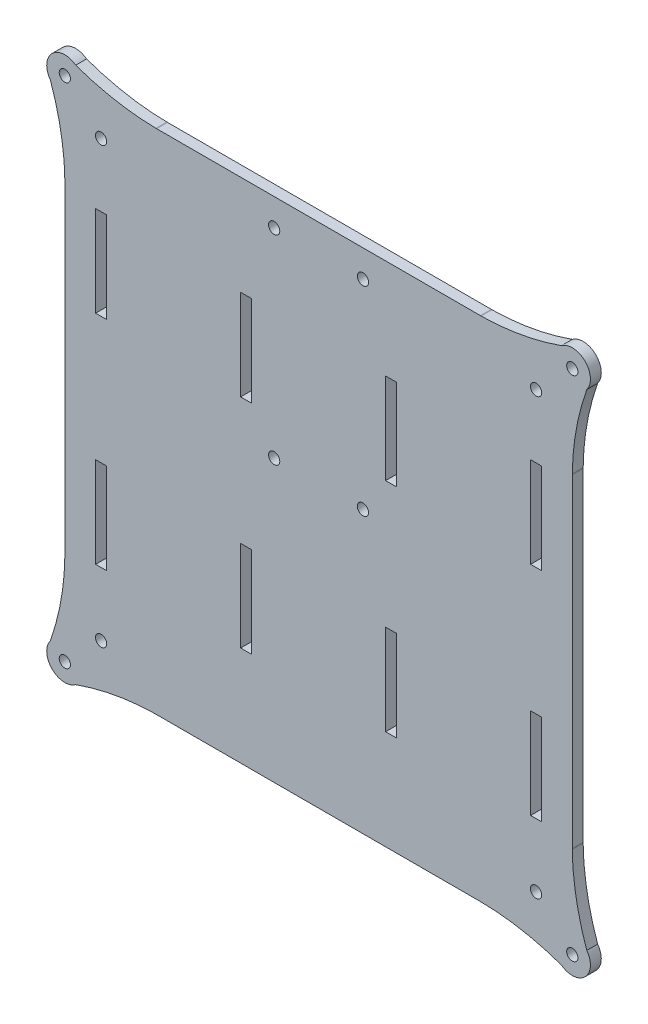
from build123d import *

# Parameters (mm, degrees)
SKETCH_1_W          = 140
SKETCH_1_H          = 140
SKETCH_1_R          = 1.55
EXTRUDE_1_DEPTH     = 3
SKETCH_2_R          = 1.55
SKETCH_2_W          = 3
SKETCH_2_H          = 25
CUT_EXTRUDE_1_DEPTH = 100.040395799
SKETCH_3_R          = 3
SKETCH_3_R_2        = 1.55
EXTRUDE_2_DEPTH     = 3
FILLET_1_R          = 10
SKETCH_7_W          = 252.152927368
SKETCH_7_H          = 251.6818607
CUT_EXTRUDE_3_DEPTH = 3
SKETCH_8_R          = 1.55
CUT_EXTRUDE_4_DEPTH = 3


with BuildPart() as part:
    # 草圖1 → 填料-伸長1 (new body)
    with BuildSketch(Plane.XY):
        Rectangle(SKETCH_1_W, SKETCH_1_H)
        with Locations((-60, 60)):
            Circle(SKETCH_1_R, mode=Mode.SUBTRACT)
        with Locations((60, 60)):
            Circle(SKETCH_1_R, mode=Mode.SUBTRACT)
        with Locations((60, -60)):
            Circle(SKETCH_1_R, mode=Mode.SUBTRACT)
        with Locations((-60, -60)):
            Circle(SKETCH_1_R, mode=Mode.SUBTRACT)
    extrude(amount=EXTRUDE_1_DEPTH)

    # 草圖2 → 除料-伸長1 (cut, through all)
    with BuildSketch(Plane.XY.offset(3)):
        with Locations((-12.25, 62.5)):
            Circle(SKETCH_2_R)
        with Locations((12.25, 62.5)):
            Circle(SKETCH_2_R)
        with Locations((-12.25, 7.5)):
            Circle(SKETCH_2_R)
        with Locations((12.25, 7.5)):
            Circle(SKETCH_2_R)
        with Locations((-60, -30)):
            Rectangle(SKETCH_2_W, SKETCH_2_H)
        with Locations((-60, 30)):
            Rectangle(SKETCH_2_W, SKETCH_2_H)
        with Locations((-20, -30)):
            Rectangle(SKETCH_2_W, SKETCH_2_H)
        with Locations((-20, 30)):
            Rectangle(SKETCH_2_W, SKETCH_2_H)
        with Locations((20, 30)):
            Rectangle(SKETCH_2_W, SKETCH_2_H)
        with Locations((20, -30)):
            Rectangle(SKETCH_2_W, SKETCH_2_H)
        with Locations((60, -30)):
            Rectangle(SKETCH_2_W, SKETCH_2_H)
        with Locations((60, 30)):
            Rectangle(SKETCH_2_W, SKETCH_2_H)
    extrude(amount=-CUT_EXTRUDE_1_DEPTH, mode=Mode.SUBTRACT)

    # 草圖3 → 填料-伸長2 (add)
    # profile 1 of 4: a face of its own
    with BuildSketch(Plane.XY.offset(3)):
        with BuildLine():
            Line((-79.393398282, 100.606601718), (-48.786796564, 70))
            Line((-48.786796564, 70), (-70, 70))
            Line((-70, 70), (-70, 48.786796564))
            Line((-70, 48.786796564), (-100.606601718, 79.393398282))
            ThreePointArc((-100.606601718, 79.393398282), (-100.606601718, 100.606601718), (-79.393398282, 100.606601718))
        make_face()
        with Locations((-90, 90)):
            Circle(SKETCH_3_R, mode=Mode.SUBTRACT)
        with Locations((-81, 90)):
            Circle(SKETCH_3_R_2, mode=Mode.SUBTRACT)
        with Locations((-90, 98)):
            Circle(SKETCH_3_R_2, mode=Mode.SUBTRACT)
        with Locations(Location((-99, 90, 0), (0, 0, 180))):
            Circle(SKETCH_3_R_2, mode=Mode.SUBTRACT)
        with Locations(Location((-90, 82, 0), (0, 0, 180))):
            Circle(SKETCH_3_R_2, mode=Mode.SUBTRACT)
    # profile 2 of 4: a face of its own
    with BuildSketch(Plane.XY.offset(3)):
        with BuildLine():
            Line((48.786796564, 70), (70, 70))
            Line((70, 70), (70, 48.786796564))
            Line((70, 48.786796564), (100.606601718, 79.393398282))
            ThreePointArc((100.606601718, 79.393398282), (100.606601718, 100.606601718), (79.393398282, 100.606601718))
            Line((79.393398282, 100.606601718), (48.786796564, 70))
        make_face()
        with Locations(Location((81, 90, 0), (0, 0, 180))):
            Circle(SKETCH_3_R_2, mode=Mode.SUBTRACT)
        with Locations(Location((90, 90, 0), (0, 0, 180))):
            Circle(SKETCH_3_R, mode=Mode.SUBTRACT)
        with Locations((90, 82)):
            Circle(SKETCH_3_R_2, mode=Mode.SUBTRACT)
        with Locations(Location((90, 98, 0), (0, 0, 180))):
            Circle(SKETCH_3_R_2, mode=Mode.SUBTRACT)
        with Locations((99, 90)):
            Circle(SKETCH_3_R_2, mode=Mode.SUBTRACT)
    # profile 3 of 4: a face of its own
    with BuildSketch(Plane.XY.offset(3)):
        with BuildLine():
            Line((-48.786796564, -70), (-70, -70))
            Line((-70, -70), (-70, -48.786796564))
            Line((-70, -48.786796564), (-100.606601718, -79.393398282))
            ThreePointArc((-100.606601718, -79.393398282), (-100.606601718, -100.606601718), (-79.393398282, -100.606601718))
            Line((-79.393398282, -100.606601718), (-48.786796564, -70))
        make_face()
        with Locations((-90, -82)):
            Circle(SKETCH_3_R_2, mode=Mode.SUBTRACT)
        with Locations(Location((-90, -90, 0), (0, 0, 180))):
            Circle(SKETCH_3_R, mode=Mode.SUBTRACT)
        with Locations(Location((-81, -90, 0), (0, 0, 180))):
            Circle(SKETCH_3_R_2, mode=Mode.SUBTRACT)
        with Locations(Location((-90, -98, 0), (0, 0, 180))):
            Circle(SKETCH_3_R_2, mode=Mode.SUBTRACT)
        with Locations((-99, -90)):
            Circle(SKETCH_3_R_2, mode=Mode.SUBTRACT)
    # profile 4 of 4: a face of its own
    with BuildSketch(Plane.XY.offset(3)):
        with BuildLine():
            Line((79.393398282, -100.606601718), (48.786796564, -70))
            Line((48.786796564, -70), (70, -70))
            Line((70, -70), (70, -48.786796564))
            Line((70, -48.786796564), (100.606601718, -79.393398282))
            ThreePointArc((100.606601718, -79.393398282), (100.606601718, -100.606601718), (79.393398282, -100.606601718))
        make_face()
        with Locations(Location((90, -82, 0), (0, 0, 180))):
            Circle(SKETCH_3_R_2, mode=Mode.SUBTRACT)
        with Locations((90, -90)):
            Circle(SKETCH_3_R, mode=Mode.SUBTRACT)
        with Locations((81, -90)):
            Circle(SKETCH_3_R_2, mode=Mode.SUBTRACT)
        with Locations((90, -98)):
            Circle(SKETCH_3_R_2, mode=Mode.SUBTRACT)
        with Locations(Location((99, -90, 0), (0, 0, 180))):
            Circle(SKETCH_3_R_2, mode=Mode.SUBTRACT)
    extrude(amount=-EXTRUDE_2_DEPTH)

    # 圓角1
    fillet_1_edges = [part.edges().sort_by_distance(p)[0] for p in [
        (-48.786796564, 70, 1.5),
        (-70, 48.786796564, 1.5),
        (70, 48.786796564, 1.5),
        (48.786796564, 70, 1.5),
        (-70, -48.786796564, 1.5),
        (-48.786796564, -70, 1.5),
        (48.786796564, -70, 1.5),
        (70, -48.786796564, 1.5),
    ]]
    fillet(fillet_1_edges, radius=FILLET_1_R)

    # 草圖7 → 除料-伸長3 (cut)
    with BuildSketch(Plane.XY.offset(3)):
        Rectangle(SKETCH_7_W, SKETCH_7_H)
        with BuildLine():
            Line((-44.644660941, 70), (44.644660941, 70))
            add(Edge.make_bspline(
                [(67.004508048, 74.00337707), (55.992453544, 70.111599189), (44.644660941, 70)],
                knots=[0, 0, 0, 0.944247476, 0.944247476, 0.944247476], degree=2))
            ThreePointArc((67.004508048, 74.00337707), (73.535533906, 73.535533906), (74.00337707, 67.004508048))
            add(Edge.make_bspline(
                [(74.00337707, 67.004508048), (70.111599189, 55.992453544), (70, 44.644660941)],
                knots=[0, 0, 0, 0.944247476, 0.944247476, 0.944247476], degree=2))
            Line((70, 44.644660941), (70, -44.644660941))
            add(Edge.make_bspline(
                [(74.00337707, -67.004508048), (70.111599189, -55.992453544), (70, -44.644660941)],
                knots=[0, 0, 0, 0.944247476, 0.944247476, 0.944247476], degree=2))
            ThreePointArc((74.00337707, -67.004508048), (73.535533906, -73.535533906), (67.004508048, -74.00337707))
            add(Edge.make_bspline(
                [(67.004508048, -74.00337707), (55.992453544, -70.111599189), (44.644660941, -70)],
                knots=[0, 0, 0, 0.944247476, 0.944247476, 0.944247476], degree=2))
            Line((44.644660941, -70), (-44.644660941, -70))
            add(Edge.make_bspline(
                [(-67.004508048, -74.00337707), (-55.992453544, -70.111599189), (-44.644660941, -70)],
                knots=[0, 0, 0, 0.944247476, 0.944247476, 0.944247476], degree=2))
            ThreePointArc((-67.004508048, -74.00337707), (-73.535533906, -73.535533906), (-74.00337707, -67.004508048))
            add(Edge.make_bspline(
                [(-74.00337707, -67.004508048), (-70.111599189, -55.992453544), (-70, -44.644660941)],
                knots=[0, 0, 0, 0.944247476, 0.944247476, 0.944247476], degree=2))
            Line((-70, -44.644660941), (-70, 44.644660941))
            add(Edge.make_bspline(
                [(-74.00337707, 67.004508048), (-70.111599189, 55.992453544), (-70, 44.644660941)],
                knots=[0, 0, 0, 0.944247476, 0.944247476, 0.944247476], degree=2))
            ThreePointArc((-74.00337707, 67.004508048), (-73.535533906, 73.535533906), (-67.004508048, 74.00337707))
            add(Edge.make_bspline(
                [(-67.004508048, 74.00337707), (-55.992453544, 70.111599189), (-44.644660941, 70)],
                knots=[0, 0, 0, 0.944247476, 0.944247476, 0.944247476], degree=2))
        make_face(mode=Mode.SUBTRACT)
    extrude(amount=-CUT_EXTRUDE_3_DEPTH, mode=Mode.SUBTRACT)

    # 草圖8 → 除料-伸長4 (cut)
    with BuildSketch(Plane.XY.offset(3)):
        with Locations((-70, 70)):
            Circle(SKETCH_8_R)
        with Locations((70, 70)):
            Circle(SKETCH_8_R)
        with Locations((70, -70)):
            Circle(SKETCH_8_R)
        with Locations((-70, -70)):
            Circle(SKETCH_8_R)
    extrude(amount=-CUT_EXTRUDE_4_DEPTH, mode=Mode.SUBTRACT)


solid = part.part
